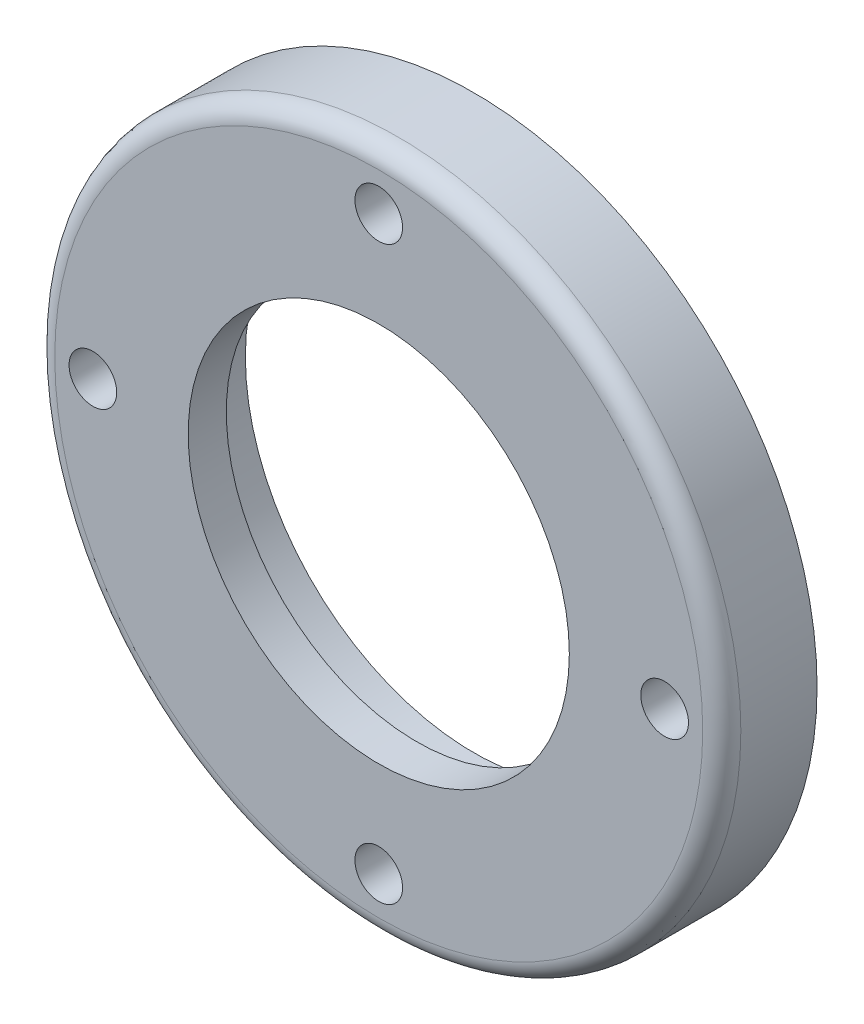
from build123d import *

# Parameters (mm, degrees)
SKETCH_1_R      = 18
SKETCH_1_R_2    = 12
SKETCH_1_R_3    = 1.25
EXTRUDE_1_DEPTH = 5
EXTRUDE_START   = -2
SKETCH_2_R      = 12
SKETCH_2_R_2    = 10
EXTRUDE_2_DEPTH = 2
FILLET_1_R      = 1


with BuildPart() as part:
    # 草图1 → 凸台-拉伸1 (new body)
    with BuildSketch(Plane.XY):
        Circle(SKETCH_1_R)
        Circle(SKETCH_1_R_2, mode=Mode.SUBTRACT)
        with Locations((0, 15)):
            Circle(SKETCH_1_R_3, mode=Mode.SUBTRACT)
        with Locations((-15, 0)):
            Circle(SKETCH_1_R_3, mode=Mode.SUBTRACT)
        with Locations((0, -15)):
            Circle(SKETCH_1_R_3, mode=Mode.SUBTRACT)
        with Locations((15, 0)):
            Circle(SKETCH_1_R_3, mode=Mode.SUBTRACT)
    extrude(amount=EXTRUDE_1_DEPTH)

    # 草图2 → 凸台-拉伸2 (add)
    with BuildSketch(Plane.XY.offset(5).offset(EXTRUDE_START)):
        Circle(SKETCH_2_R)
        Circle(SKETCH_2_R_2, mode=Mode.SUBTRACT)
    extrude(amount=EXTRUDE_2_DEPTH)

    # 圆角1
    fillet_1_edges = [part.edges().sort_by_distance(p)[0] for p in [
        (-18, 0, 5),
    ]]
    fillet(fillet_1_edges, radius=FILLET_1_R)


solid = part.part
